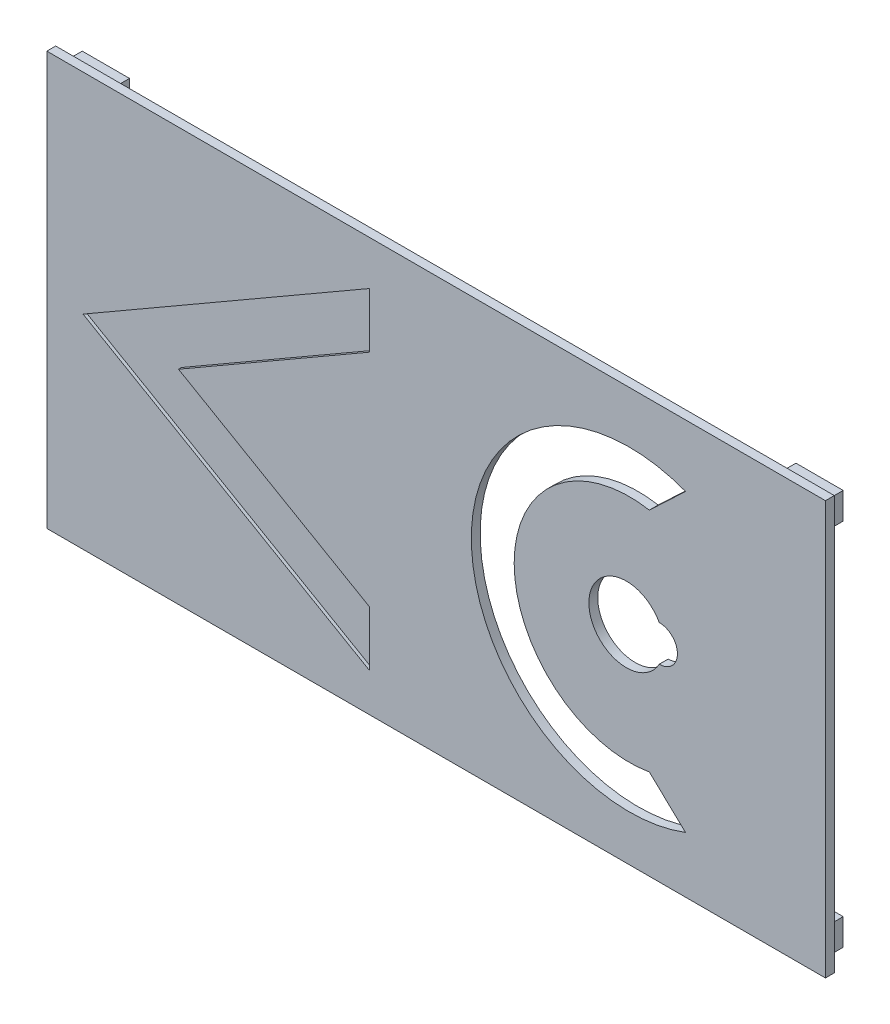
from build123d import *

# Parameters (mm, degrees)
SKETCH1_W                 = 131.85
SKETCH1_H                 = 70
BOSS_EXTRUDE1_DEPTH       = 1.5
CUT_EXTRUDE1_REACH        = 137.268
SKETCH4_W                 = 8
SKETCH4_H                 = 4.5
SKETCH4_W_2               = 5
SKETCH4_H_2               = 1.5
BOSS_EXTRUDE2_DEPTH       = 3
MIRROR2_COPY_1_SKETCH_W   = 8
MIRROR2_COPY_1_SKETCH_H   = 4.5
MIRROR2_COPY_1_SKETCH_W_2 = 5
MIRROR2_COPY_1_SKETCH_H_2 = 1.5
MIRROR2_COPY_1_DEPTH      = 3
CUT_EXTRUDE2_REACH        = 137.335
CUT_EXTRUDE3_DEPTH        = 0.5


with BuildPart() as part:
    # Sketch1 → Boss-Extrude1 (new body)
    with BuildSketch(Plane.XY):
        with Locations((55.175, 25.25)):
            Rectangle(SKETCH1_W, SKETCH1_H)
    extrude(amount=BOSS_EXTRUDE1_DEPTH)

    # Sketch2 → Cut-Extrude1 (cut, up to next)
    with BuildSketch(Plane.XY.offset(1.5), mode=Mode.PRIVATE) as cut_extrude1_sk1:
        with BuildLine():
            Line((92.957060126, 22.2), (92.9875, 22.2))
            ThreePointArc((92.9875, 22.2), (96.0375, 25.25), (92.9875, 28.3))
            Line((92.9875, 28.3), (92.957060126, 28.3))
            ThreePointArc((92.957060126, 28.3), (81.0375, 25.25), (92.957060126, 22.2))
        make_face()
    cut_extrude1_tool1 = extrude(cut_extrude1_sk1.sketch, amount=-CUT_EXTRUDE1_REACH, mode=Mode.PRIVATE) & part.part
    add(cut_extrude1_tool1.solids().sort_by_distance((87.98685, 25.25, 1.5))[0], mode=Mode.SUBTRACT)

    # Sketch4 → Boss-Extrude2 (add)
    with BuildSketch(Plane(origin=(0, 0, 0), x_dir=(-1, 0, 0), z_dir=(0, 0, -1))):
        with Locations((-115.6, 56.5)):
            Rectangle(SKETCH4_W, SKETCH4_H)
        with Locations((-115.6, 56.5)):
            Rectangle(SKETCH4_W_2, SKETCH4_H_2, mode=Mode.SUBTRACT)
    boss_extrude2 = extrude(amount=BOSS_EXTRUDE2_DEPTH)

    # Mirror1: Boss-Extrude2 across plane
    add(boss_extrude2.mirror(Plane.ZX.offset(25.25)))

    # Mirror2: Boss-Extrude2 across plane
    add(boss_extrude2.mirror(Plane(origin=(55.175, 0, 0), x_dir=(0, 0, 1), z_dir=(1, 0, 0))))

    # Mirror2 copy 1 sketch → Mirror2 copy 1 (add)
    with BuildSketch(Plane(origin=(110.35, 50.5, 0), x_dir=(1, 0, 0), z_dir=(0, 0, -1))):
        with Locations((-115.6, 56.5)):
            Rectangle(MIRROR2_COPY_1_SKETCH_W, MIRROR2_COPY_1_SKETCH_H)
        with Locations((-115.6, 56.5)):
            Rectangle(MIRROR2_COPY_1_SKETCH_W_2, MIRROR2_COPY_1_SKETCH_H_2, mode=Mode.SUBTRACT)
    extrude(amount=MIRROR2_COPY_1_DEPTH)

    # Sketch5 → Cut-Extrude2 (cut, up to next)
    with BuildSketch(Plane.XY.offset(1.5), mode=Mode.PRIVATE) as cut_extrude2_sk1:
        with BuildLine():
            Line((91.274215328, 5.546350365), (97.408092333, -0.255965721))
            ThreePointArc((97.408092333, -0.255965721), (61.130444856, 24.75), (97.408092333, 49.755965721))
            Line((97.408092333, 49.755965721), (91.274215328, 43.953649635))
            ThreePointArc((91.274215328, 43.953649635), (68.3875, 24.75), (91.274215328, 5.546350365))
        make_face()
    cut_extrude2_tool1 = extrude(cut_extrude2_sk1.sketch, amount=-CUT_EXTRUDE2_REACH, mode=Mode.PRIVATE) & part.part
    add(cut_extrude2_tool1.solids().sort_by_distance((67.740984, 24.75, 1.5))[0], mode=Mode.SUBTRACT)

    # Sketch6 → Cut-Extrude3 (cut)
    with BuildSketch(Plane.XY.offset(1.5)):
        Polygon((-4.619922612, 24.75), (43.8775, -3.25), (43.8775, 6.083333333), (11.545884925, 24.75), (43.8775, 43.416666667), (43.8775, 52.75), align=None)
    extrude(amount=-CUT_EXTRUDE3_DEPTH, mode=Mode.SUBTRACT)


solid = part.part
